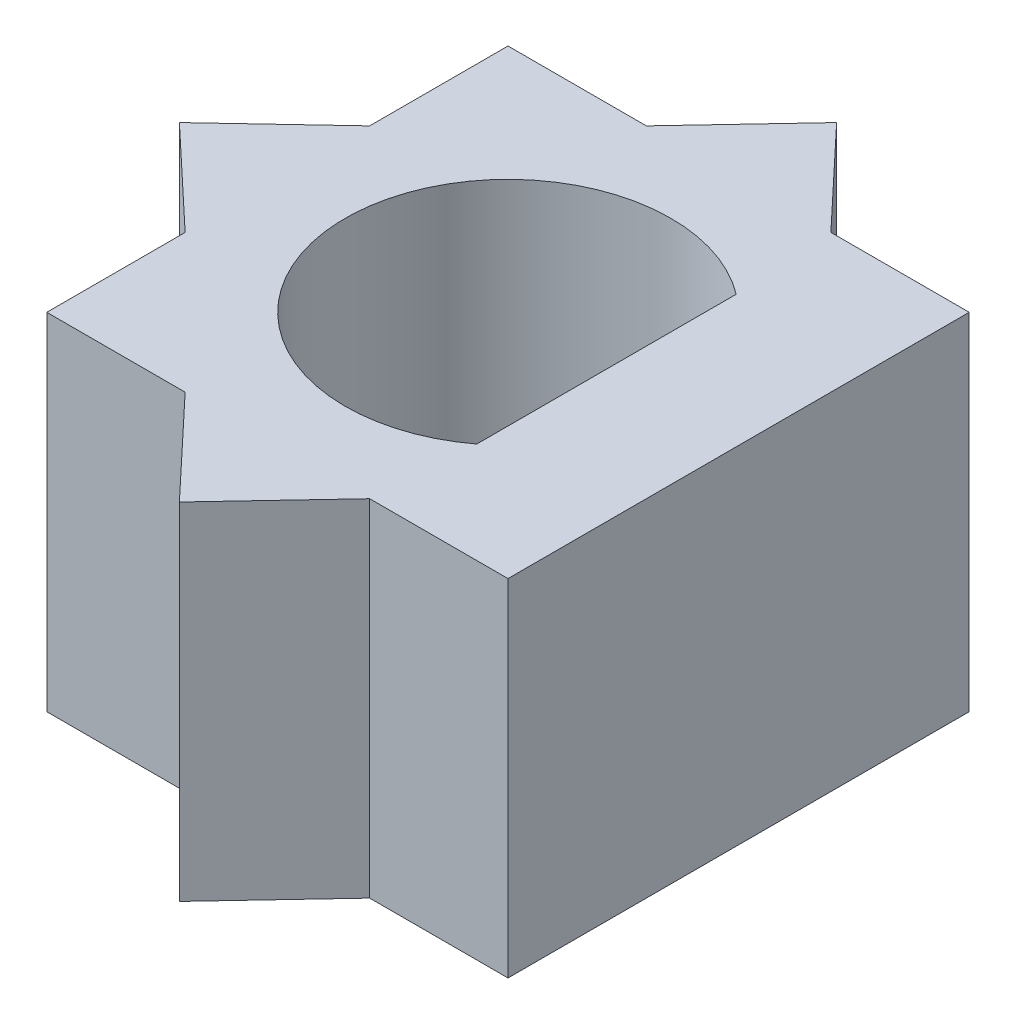
from build123d import *

# Parameters (mm, degrees)
ESQUISSE1_W        = 8
ESQUISSE1_H        = 8
ESQUISSE1_R        = 2.825
BOSS_EXTRU_1_DEPTH = 6


with BuildPart() as part:
    # Esquisse1 → Boss.-Extru.1 (new body)
    # profile 1 of 6: a face of its own
    with BuildSketch(Plane(origin=(0, 0, 0), x_dir=(1, 0, 0), z_dir=(0, 1, 0))):
        Rectangle(ESQUISSE1_W, ESQUISSE1_H)
        Circle(ESQUISSE1_R, mode=Mode.SUBTRACT)
    # profile 2 of 6: a face of its own
    with BuildSketch(Plane(origin=(0, 0, 0), x_dir=(1, 0, 0), z_dir=(0, 1, 0))):
        Polygon((1.6, -4), (-1.6, -4), (0, -5.7), align=None)
    # profile 3 of 6: a face of its own
    with BuildSketch(Plane(origin=(0, 0, 0), x_dir=(1, 0, 0), z_dir=(0, 1, 0))):
        Polygon((-1.6, 4), (-4, 4), (-4, 1.6), (-4, -1.6), (-4, -4), (-1.6, -4), (1.6, -4), (4, -4), (4, 4), (1.6, 4), align=None)
        with BuildLine():
            ThreePointArc((1.708252031, -2.25), (-2.825, 0), (1.708252031, 2.25))
            ThreePointArc((1.708252031, 2.25), (2.530458159, 1.255948449), (2.825, 0))
            ThreePointArc((2.825, 0), (2.530458159, -1.255948449), (1.708252031, -2.25))
        make_face(mode=Mode.SUBTRACT)
    # profile 4 of 6: a face of its own
    with BuildSketch(Plane(origin=(0, 0, 0), x_dir=(1, 0, 0), z_dir=(0, 1, 0))):
        with BuildLine():
            ThreePointArc((2.825, 0), (2.530458159, 1.255948449), (1.708252031, 2.25))
            Line((1.708252031, 2.25), (1.708252031, -2.25))
            ThreePointArc((1.708252031, -2.25), (2.530458159, -1.255948449), (2.825, 0))
        make_face()
    # profile 5 of 6: a face of its own
    with BuildSketch(Plane(origin=(0, 0, 0), x_dir=(1, 0, 0), z_dir=(0, 1, 0))):
        Polygon((-4, -1.6), (-4, 1.6), (-5.7, 0), align=None)
    # profile 6 of 6: a face of its own
    with BuildSketch(Plane(origin=(0, 0, 0), x_dir=(1, 0, 0), z_dir=(0, 1, 0))):
        Polygon((0, 5.7), (-1.6, 4), (1.6, 4), align=None)
    extrude(amount=BOSS_EXTRU_1_DEPTH)


solid = part.part
